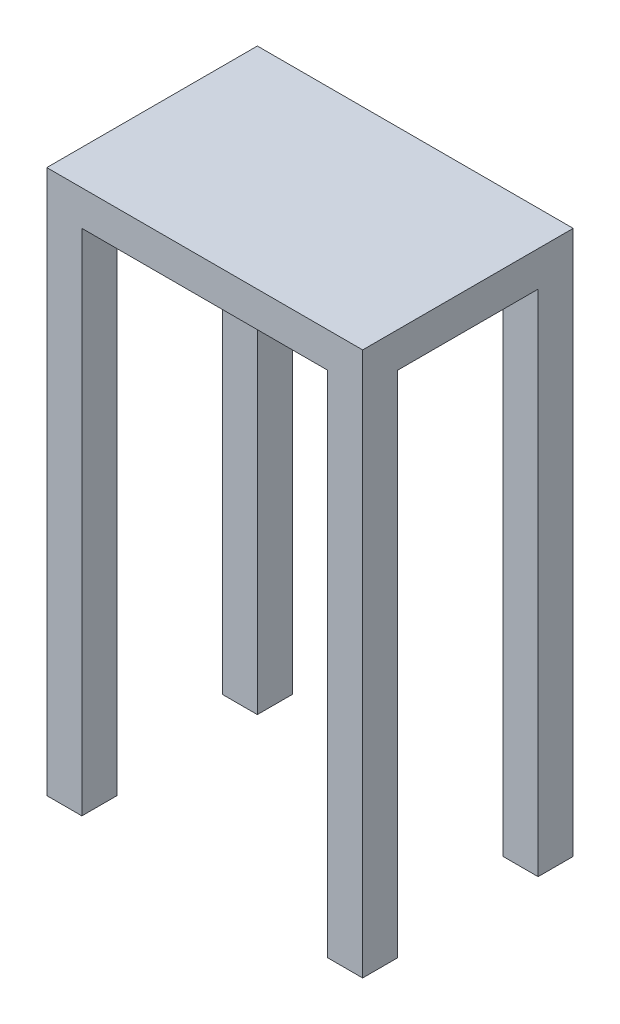
from build123d import *

# Parameters (mm, degrees)
SKETCH1_W           = 90
SKETCH1_H           = 60
BOSS_EXTRUDE1_DEPTH = 10
SKETCH2_W           = 10
SKETCH2_H           = 10
BOSS_EXTRUDE2_DEPTH = 145


with BuildPart() as part:
    # Sketch1 → Boss-Extrude1 (new body)
    with BuildSketch(Plane(origin=(0, 0, 0), x_dir=(1, 0, 0), z_dir=(0, 1, 0))):
        Rectangle(SKETCH1_W, SKETCH1_H)
    extrude(amount=BOSS_EXTRUDE1_DEPTH)

    # Sketch2 → Boss-Extrude2 (add)
    with BuildSketch(Plane.XZ):
        with Locations((-40, 25)):
            Rectangle(SKETCH2_W, SKETCH2_H)
        with Locations((-40, -25)):
            Rectangle(SKETCH2_W, SKETCH2_H)
        with Locations((40, -25)):
            Rectangle(SKETCH2_W, SKETCH2_H)
        with Locations((40, 25)):
            Rectangle(SKETCH2_W, SKETCH2_H)
    extrude(amount=BOSS_EXTRUDE2_DEPTH)


solid = part.part
